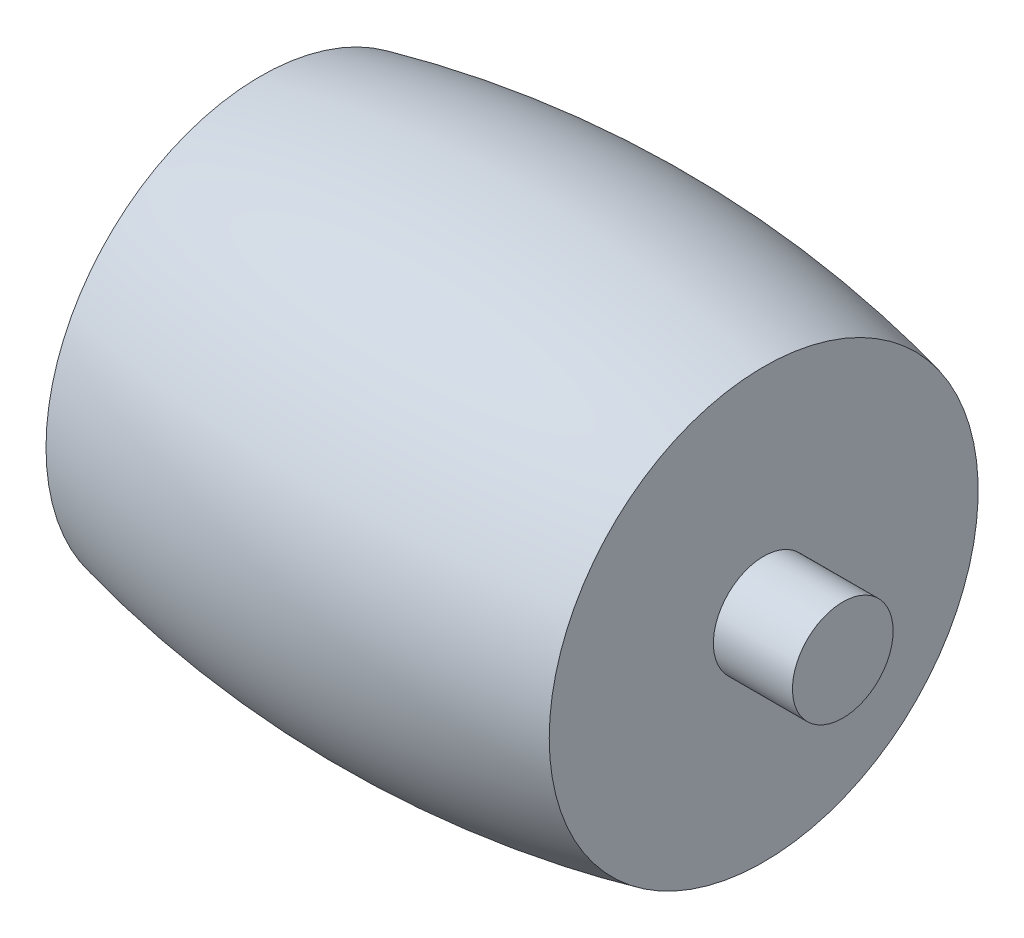
from build123d import *

# Parameters (mm, degrees)
SKETCH4_R           = 3.683
BOSS_EXTRUDE1_DEPTH = 5.789022458


with BuildPart() as part:
    # Sketch2 → Revolve1 (revolve)
    with BuildSketch(Plane.XY, mode=Mode.PRIVATE) as revolve1_sk:
        with BuildLine():
            Line((-18.415, 0), (-18.415, 15.697572511))
            ThreePointArc((-18.415, 15.697572511), (-9.266184884, 17.257739329), (0, 17.78))
            ThreePointArc((0, 17.78), (9.266184884, 17.257739329), (18.415, 15.697572511))
            Line((18.415, 15.697572511), (18.415, 0))
            Line((18.415, 0), (-18.415, 0))
        make_face()
    revolve(revolve1_sk.sketch.rotate(Axis((-18.415, 0, 0), (1, 0, 0)), 90), axis=Axis((-18.415, 0, 0), (1, 0, 0)))

    # Sketch4 → Boss-Extrude1 (add)
    with BuildSketch(Plane(origin=(18.415, 0, 0), x_dir=(0, 0, -1), z_dir=(1, 0, 0))):
        Circle(SKETCH4_R)
    boss_extrude1 = extrude(amount=BOSS_EXTRUDE1_DEPTH)

    # Mirror1: Boss-Extrude1 across plane
    add(boss_extrude1.mirror(Plane(origin=(0, 0, 0), x_dir=(0, 0, 1), z_dir=(1, 0, 0))))


solid = part.part
